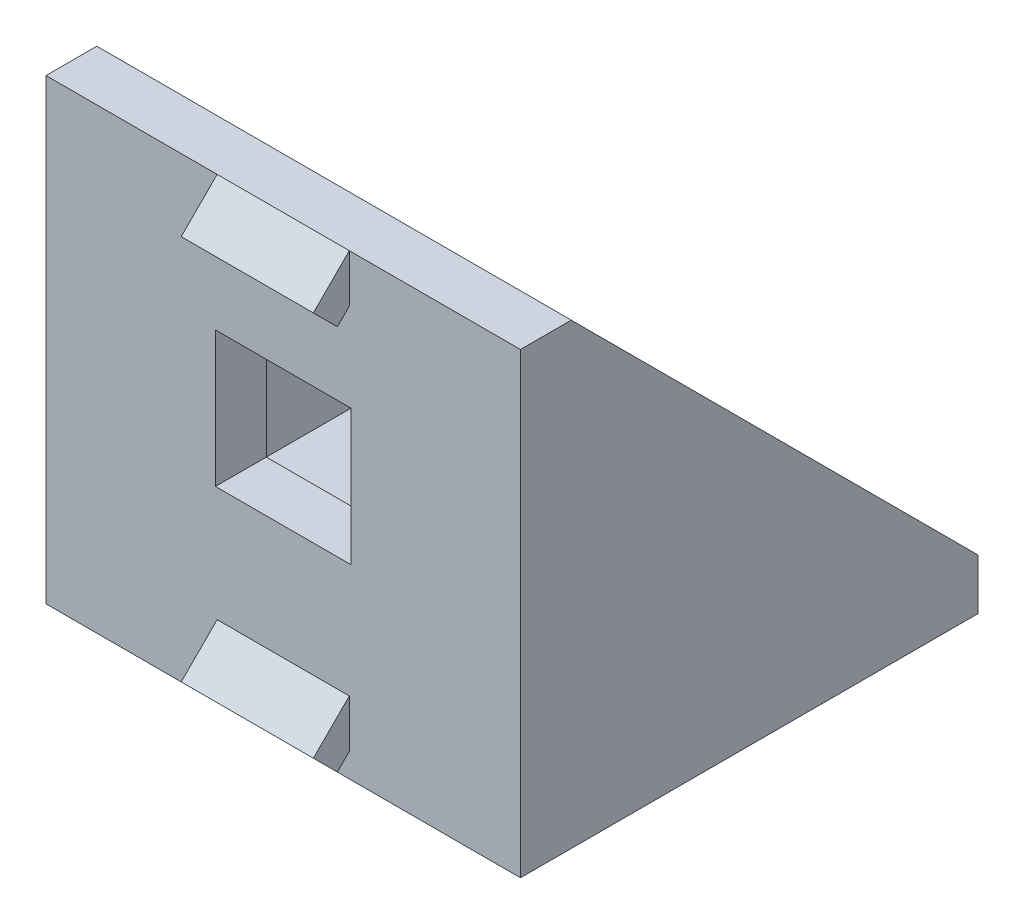
from build123d import *

# Parameters (mm, degrees)
BOSS_EXTRUDE1_DEPTH = 28
SKETCH2_W           = 24
SKETCH2_H           = 24
CUT_EXTRUDE1_DEPTH  = 24
CUT_EXTRUDE2_REACH  = 47.706
SKETCH3_W           = 8
SKETCH3_H           = 8
CUT_EXTRUDE3_REACH  = 47.706
SKETCH4_W           = 8
SKETCH4_H           = 8
BOSS_EXTRUDE2_DEPTH = 3.9


with BuildPart() as part:
    # Sketch1 → Boss-Extrude1 (new body)
    with BuildSketch(Plane(origin=(0, 0, 0), x_dir=(0, 0, -1), z_dir=(1, 0, 0))):
        Polygon((0, 0), (0, 27), (3, 27), (27, 3), (27, 0), align=None)
    extrude(amount=BOSS_EXTRUDE1_DEPTH)

    # Sketch2 → Cut-Extrude1 (cut)
    with BuildSketch(Plane(origin=(0, 0, -27), x_dir=(-1, 0, 0), z_dir=(0, 0, -1))):
        with Locations((-14, 15)):
            Rectangle(SKETCH2_W, SKETCH2_H)
    extrude(amount=-CUT_EXTRUDE1_DEPTH, mode=Mode.SUBTRACT)

    # Sketch3 → Cut-Extrude2 (cut, up to next)
    with BuildSketch(Plane(origin=(0, 0, -3), x_dir=(-1, 0, 0), z_dir=(0, 0, -1)), mode=Mode.PRIVATE) as cut_extrude2_sk1:
        with Locations((-14, 15)):
            Rectangle(SKETCH3_W, SKETCH3_H)
    cut_extrude2_tool1 = extrude(cut_extrude2_sk1.sketch, amount=-CUT_EXTRUDE2_REACH, mode=Mode.PRIVATE) & part.part
    add(cut_extrude2_tool1.solids().sort_by_distance((14, 15, -3))[0], mode=Mode.SUBTRACT)

    # Sketch4 → Cut-Extrude3 (cut, up to next)
    with BuildSketch(Plane(origin=(0, 3, 0), x_dir=(1, 0, 0), z_dir=(0, 1, 0)), mode=Mode.PRIVATE) as cut_extrude3_sk1:
        with Locations((14, 15)):
            Rectangle(SKETCH4_W, SKETCH4_H)
    cut_extrude3_tool1 = extrude(cut_extrude3_sk1.sketch, amount=-CUT_EXTRUDE3_REACH, mode=Mode.PRIVATE) & part.part
    add(cut_extrude3_tool1.solids().sort_by_distance((14, 3, -15))[0], mode=Mode.SUBTRACT)

    # Sketch5 → Boss-Extrude2 (add, symmetric)
    with BuildSketch(Plane(origin=(14, 0, 0), x_dir=(0, 0, -1), z_dir=(1, 0, 0))):
        Polygon((27, 0), (24.878679656, -2.121320344), (23.464466094, -0.707106781), (24.171572875, 0), align=None)
        Polygon((2.121320344, -2.121320344), (0.707106781, -0.707106781), (1.414213562, 0), (4.242640687, 0), align=None)
        Polygon((0, 1.414213562), (-0.707106781, 0.707106781), (-2.121320344, 2.121320344), (0, 4.242640687), align=None)
        Polygon((-0.707106781, 23.464466094), (-2.121320344, 24.878679656), (0, 27), (0, 24.171572875), align=None)
    extrude(amount=BOSS_EXTRUDE2_DEPTH, both=True)


solid = part.part
